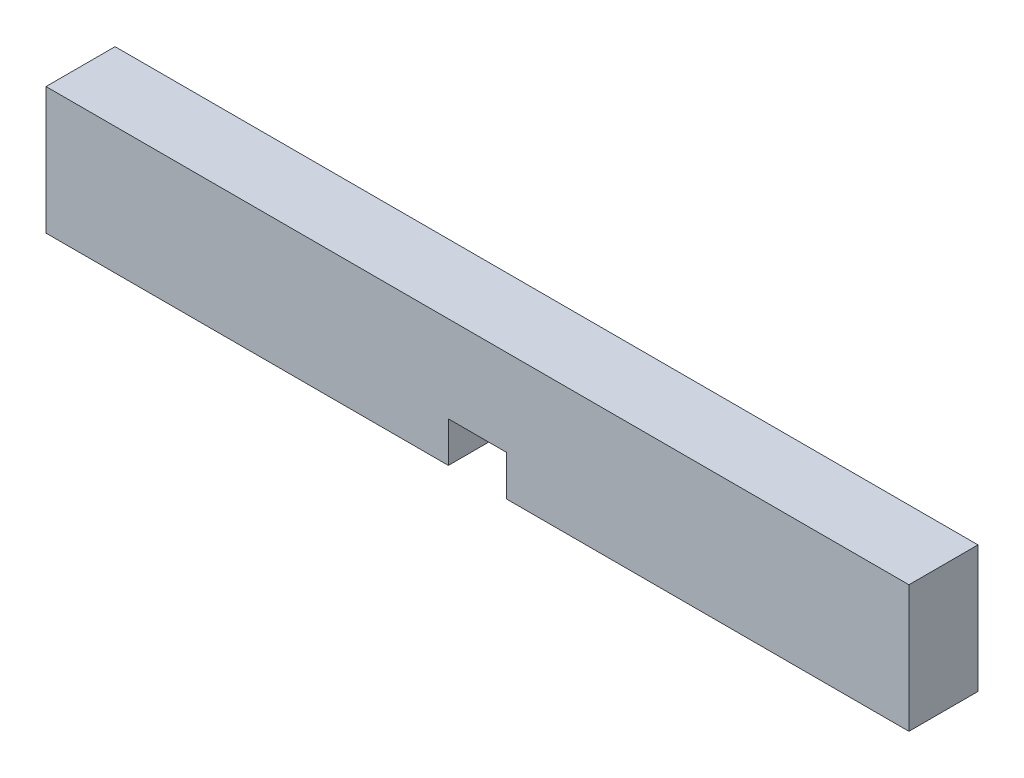
from build123d import *

# Parameters (mm, degrees)
BOSS_EXTRUDE1_DEPTH = 2.35


with BuildPart() as part:
    # Sketch1 → Boss-Extrude1 (new, symmetric)
    with BuildSketch(Plane.XY):
        Polygon((-1.98, -4.32), (-1.98, -1.571782428), (1.98, -1.571782428), (1.98, -4.32), (29.36, -4.32), (29.36, 4.32), (-29.36, 4.32), (-29.36, -4.32), align=None)
    extrude(amount=BOSS_EXTRUDE1_DEPTH, both=True)


solid = part.part
